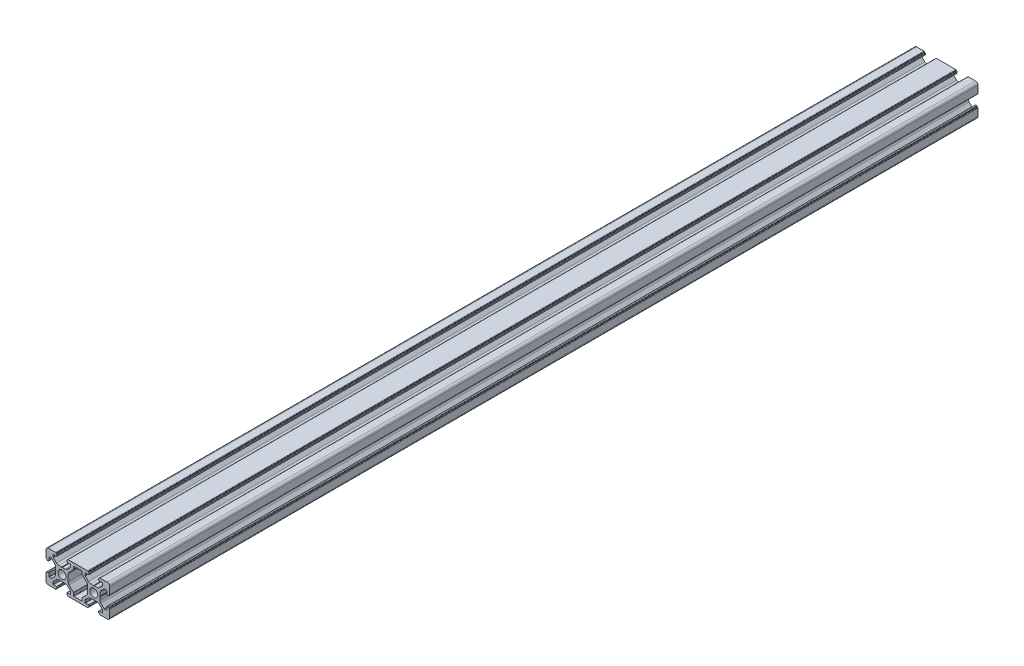
from build123d import *

# Parameters (mm, degrees)
SKETCH_1_R      = 2.5
EXTRUDE_1_DEPTH = 545


with BuildPart() as part:
    # 草图1 → 凸台-拉伸1 (new body)
    with BuildSketch(Plane.XY):
        with BuildLine():
            Line((4.5, -6.68492424), (4.5, -7.9))
            ThreePointArc((4.5, -7.9), (4.587867966, -8.112132034), (4.8, -8.2))
            Line((4.8, -8.2), (6.6, -8.2))
            ThreePointArc((6.6, -8.2), (6.812132034, -8.287867966), (6.9, -8.5))
            Line((6.9, -8.5), (6.9, -9.2))
            ThreePointArc((6.9, -9.2), (6.812132034, -9.412132034), (6.6, -9.5))
            Line((6.6, -9.5), (6.4, -9.5))
            Line((6.4, -9.5), (6.4, -9.7))
            ThreePointArc((6.4, -9.7), (6.312132034, -9.912132034), (6.1, -10))
            Line((6.1, -10), (-6.1, -10))
            ThreePointArc((-6.1, -10), (-6.312132034, -9.912132034), (-6.4, -9.7))
            Line((-6.4, -9.7), (-6.4, -9.5))
            Line((-6.4, -9.5), (-6.6, -9.5))
            ThreePointArc((-6.6, -9.5), (-6.812132034, -9.412132034), (-6.9, -9.2))
            Line((-6.9, -9.2), (-6.9, -8.5))
            ThreePointArc((-6.9, -8.5), (-6.812132034, -8.287867966), (-6.6, -8.2))
            Line((-6.6, -8.2), (-4.8, -8.2))
            ThreePointArc((-4.8, -8.2), (-4.587867966, -8.112132034), (-4.5, -7.9))
            Line((-4.5, -7.9), (-4.5, -6.68492424))
            ThreePointArc((-4.5, -6.68492424), (-4.52283614, -6.570119211), (-4.587867966, -6.472792206))
            Line((-4.587867966, -6.472792206), (-6.574873734, -4.485786438))
            ThreePointArc((-6.574873734, -4.485786438), (-7.223720432, -4.052240935), (-7.989087297, -3.9))
            Line((-7.989087297, -3.9), (-9.8, -3.9))
            Line((-9.8, -3.9), (-10, -3.7))
            Line((-10, -3.7), (-10.2, -3.9))
            Line((-10.2, -3.9), (-12.010912703, -3.9))
            ThreePointArc((-12.010912703, -3.9), (-12.776279568, -4.052240935), (-13.425126266, -4.485786438))
            Line((-13.425126266, -4.485786438), (-15.412132034, -6.472792206))
            ThreePointArc((-15.412132034, -6.472792206), (-15.47716386, -6.570119211), (-15.5, -6.68492424))
            Line((-15.5, -6.68492424), (-15.5, -7.9))
            ThreePointArc((-15.5, -7.9), (-15.412132034, -8.112132034), (-15.2, -8.2))
            Line((-15.2, -8.2), (-13.4, -8.2))
            ThreePointArc((-13.4, -8.2), (-13.187867965, -8.287867966), (-13.1, -8.5))
            Line((-13.1, -8.5), (-13.1, -9.2))
            ThreePointArc((-13.1, -9.2), (-13.187867966, -9.412132034), (-13.4, -9.5))
            Line((-13.4, -9.5), (-13.6, -9.5))
            Line((-13.6, -9.5), (-13.6, -9.7))
            ThreePointArc((-13.6, -9.7), (-13.687867966, -9.912132034), (-13.9, -10))
            Line((-13.9, -10), (-18.5, -10))
            ThreePointArc((-18.5, -10), (-19.560660172, -9.560660172), (-20, -8.5))
            Line((-20, -8.5), (-20, -3.9))
            ThreePointArc((-20, -3.9), (-19.912132034, -3.687867966), (-19.7, -3.6))
            Line((-19.7, -3.6), (-19.5, -3.6))
            Line((-19.5, -3.6), (-19.5, -3.4))
            ThreePointArc((-19.5, -3.4), (-19.412132034, -3.187867966), (-19.2, -3.1))
            Line((-19.2, -3.1), (-18.5, -3.1))
            ThreePointArc((-18.5, -3.1), (-18.287867965, -3.187867966), (-18.2, -3.4))
            Line((-18.2, -3.4), (-18.2, -5.2))
            ThreePointArc((-18.2, -5.2), (-18.112132034, -5.412132034), (-17.9, -5.5))
            Line((-17.9, -5.5), (-16.68492424, -5.5))
            ThreePointArc((-16.68492424, -5.5), (-16.570119211, -5.47716386), (-16.472792206, -5.412132034))
            Line((-16.472792206, -5.412132034), (-14.485786437, -3.425126266))
            ThreePointArc((-14.485786437, -3.425126266), (-14.052240935, -2.776279568), (-13.9, -2.010912703))
            Line((-13.9, -2.010912703), (-13.9, -0.2))
            Line((-13.9, -0.2), (-13.7, 0))
            Line((-13.7, 0), (-13.9, 0.2))
            Line((-13.9, 0.2), (-13.9, 2.010912703))
            ThreePointArc((-13.9, 2.010912703), (-14.052240935, 2.776279568), (-14.485786437, 3.425126266))
            Line((-14.485786437, 3.425126266), (-16.472792206, 5.412132034))
            ThreePointArc((-16.472792206, 5.412132034), (-16.570119211, 5.47716386), (-16.68492424, 5.5))
            Line((-16.68492424, 5.5), (-17.9, 5.5))
            ThreePointArc((-17.9, 5.5), (-18.112132034, 5.412132034), (-18.2, 5.2))
            Line((-18.2, 5.2), (-18.2, 3.4))
            ThreePointArc((-18.2, 3.4), (-18.287867965, 3.187867966), (-18.5, 3.1))
            Line((-18.5, 3.1), (-19.2, 3.1))
            ThreePointArc((-19.2, 3.1), (-19.412132034, 3.187867966), (-19.5, 3.4))
            Line((-19.5, 3.4), (-19.5, 3.6))
            Line((-19.5, 3.6), (-19.7, 3.6))
            ThreePointArc((-19.7, 3.6), (-19.912132034, 3.687867966), (-20, 3.9))
            Line((-20, 3.9), (-20, 8.5))
            ThreePointArc((-20, 8.5), (-19.560660172, 9.560660172), (-18.5, 10))
            Line((-18.5, 10), (-13.9, 10))
            ThreePointArc((-13.9, 10), (-13.687867966, 9.912132034), (-13.6, 9.7))
            Line((-13.6, 9.7), (-13.6, 9.5))
            Line((-13.6, 9.5), (-13.4, 9.5))
            ThreePointArc((-13.4, 9.5), (-13.187867966, 9.412132034), (-13.1, 9.2))
            Line((-13.1, 9.2), (-13.1, 8.5))
            ThreePointArc((-13.1, 8.5), (-13.187867965, 8.287867966), (-13.4, 8.2))
            Line((-13.4, 8.2), (-15.2, 8.2))
            ThreePointArc((-15.2, 8.2), (-15.412132034, 8.112132034), (-15.5, 7.9))
            Line((-15.5, 7.9), (-15.5, 6.68492424))
            ThreePointArc((-15.5, 6.68492424), (-15.47716386, 6.570119211), (-15.412132034, 6.472792206))
            Line((-15.412132034, 6.472792206), (-13.425126266, 4.485786438))
            ThreePointArc((-13.425126266, 4.485786438), (-12.776279568, 4.052240935), (-12.010912703, 3.9))
            Line((-12.010912703, 3.9), (-10.2, 3.9))
            Line((-10.2, 3.9), (-10, 3.7))
            Line((-10, 3.7), (-9.8, 3.9))
            Line((-9.8, 3.9), (-7.989087297, 3.9))
            ThreePointArc((-7.989087297, 3.9), (-7.223720432, 4.052240935), (-6.574873734, 4.485786438))
            Line((-6.574873734, 4.485786438), (-4.587867966, 6.472792206))
            ThreePointArc((-4.587867966, 6.472792206), (-4.52283614, 6.570119211), (-4.5, 6.68492424))
            Line((-4.5, 6.68492424), (-4.5, 7.9))
            ThreePointArc((-4.5, 7.9), (-4.587867966, 8.112132034), (-4.8, 8.2))
            Line((-4.8, 8.2), (-6.6, 8.2))
            ThreePointArc((-6.6, 8.2), (-6.812132034, 8.287867966), (-6.9, 8.5))
            Line((-6.9, 8.5), (-6.9, 9.2))
            ThreePointArc((-6.9, 9.2), (-6.812132034, 9.412132034), (-6.6, 9.5))
            Line((-6.6, 9.5), (-6.4, 9.5))
            Line((-6.4, 9.5), (-6.4, 9.7))
            ThreePointArc((-6.4, 9.7), (-6.312132034, 9.912132034), (-6.1, 10))
            Line((-6.1, 10), (6.1, 10))
            ThreePointArc((6.1, 10), (6.312132034, 9.912132034), (6.4, 9.7))
            Line((6.4, 9.7), (6.4, 9.5))
            Line((6.4, 9.5), (6.6, 9.5))
            ThreePointArc((6.6, 9.5), (6.812132034, 9.412132034), (6.9, 9.2))
            Line((6.9, 9.2), (6.9, 8.5))
            ThreePointArc((6.9, 8.5), (6.812132034, 8.287867966), (6.6, 8.2))
            Line((6.6, 8.2), (4.8, 8.2))
            ThreePointArc((4.8, 8.2), (4.587867966, 8.112132034), (4.5, 7.9))
            Line((4.5, 7.9), (4.5, 6.68492424))
            ThreePointArc((4.5, 6.68492424), (4.52283614, 6.570119211), (4.587867966, 6.472792206))
            Line((4.587867966, 6.472792206), (6.574873734, 4.485786438))
            ThreePointArc((6.574873734, 4.485786438), (7.223720432, 4.052240935), (7.989087297, 3.9))
            Line((7.989087297, 3.9), (9.8, 3.9))
            Line((9.8, 3.9), (10, 3.7))
            Line((10, 3.7), (10.2, 3.9))
            Line((10.2, 3.9), (12.010912703, 3.9))
            ThreePointArc((12.010912703, 3.9), (12.776279568, 4.052240935), (13.425126266, 4.485786438))
            Line((13.425126266, 4.485786438), (15.412132034, 6.472792206))
            ThreePointArc((15.412132034, 6.472792206), (15.47716386, 6.570119211), (15.5, 6.68492424))
            Line((15.5, 6.68492424), (15.5, 7.9))
            ThreePointArc((15.5, 7.9), (15.412132034, 8.112132034), (15.2, 8.2))
            Line((15.2, 8.2), (13.4, 8.2))
            ThreePointArc((13.4, 8.2), (13.187867965, 8.287867966), (13.1, 8.5))
            Line((13.1, 8.5), (13.1, 9.2))
            ThreePointArc((13.1, 9.2), (13.187867966, 9.412132034), (13.4, 9.5))
            Line((13.4, 9.5), (13.6, 9.5))
            Line((13.6, 9.5), (13.6, 9.7))
            ThreePointArc((13.6, 9.7), (13.687867966, 9.912132034), (13.9, 10))
            Line((13.9, 10), (18.5, 10))
            ThreePointArc((18.5, 10), (19.560660172, 9.560660172), (20, 8.5))
            Line((20, 8.5), (20, 3.9))
            ThreePointArc((20, 3.9), (19.912132034, 3.687867966), (19.7, 3.6))
            Line((19.7, 3.6), (19.5, 3.6))
            Line((19.5, 3.6), (19.5, 3.4))
            ThreePointArc((19.5, 3.4), (19.412132034, 3.187867966), (19.2, 3.1))
            Line((19.2, 3.1), (18.5, 3.1))
            ThreePointArc((18.5, 3.1), (18.287867965, 3.187867966), (18.2, 3.4))
            Line((18.2, 3.4), (18.2, 5.2))
            ThreePointArc((18.2, 5.2), (18.112132034, 5.412132034), (17.9, 5.5))
            Line((17.9, 5.5), (16.68492424, 5.5))
            ThreePointArc((16.68492424, 5.5), (16.570119211, 5.47716386), (16.472792206, 5.412132034))
            Line((16.472792206, 5.412132034), (14.485786438, 3.425126266))
            ThreePointArc((14.485786438, 3.425126266), (14.052240935, 2.776279568), (13.9, 2.010912703))
            Line((13.9, 2.010912703), (13.9, 0.2))
            Line((13.9, 0.2), (13.7, 0))
            Line((13.7, 0), (13.9, -0.2))
            Line((13.9, -0.2), (13.9, -2.010912703))
            ThreePointArc((13.9, -2.010912703), (14.052240935, -2.776279568), (14.485786438, -3.425126266))
            Line((14.485786438, -3.425126266), (16.472792206, -5.412132034))
            ThreePointArc((16.472792206, -5.412132034), (16.570119211, -5.47716386), (16.68492424, -5.5))
            Line((16.68492424, -5.5), (17.9, -5.5))
            ThreePointArc((17.9, -5.5), (18.112132034, -5.412132034), (18.2, -5.2))
            Line((18.2, -5.2), (18.2, -3.4))
            ThreePointArc((18.2, -3.4), (18.287867965, -3.187867966), (18.5, -3.1))
            Line((18.5, -3.1), (19.2, -3.1))
            ThreePointArc((19.2, -3.1), (19.412132034, -3.187867966), (19.5, -3.4))
            Line((19.5, -3.4), (19.5, -3.6))
            Line((19.5, -3.6), (19.7, -3.6))
            ThreePointArc((19.7, -3.6), (19.912132034, -3.687867966), (20, -3.9))
            Line((20, -3.9), (20, -8.5))
            ThreePointArc((20, -8.5), (19.560660172, -9.560660172), (18.5, -10))
            Line((18.5, -10), (13.9, -10))
            ThreePointArc((13.9, -10), (13.687867966, -9.912132034), (13.6, -9.7))
            Line((13.6, -9.7), (13.6, -9.5))
            Line((13.6, -9.5), (13.4, -9.5))
            ThreePointArc((13.4, -9.5), (13.187867966, -9.412132034), (13.1, -9.2))
            Line((13.1, -9.2), (13.1, -8.5))
            ThreePointArc((13.1, -8.5), (13.187867965, -8.287867966), (13.4, -8.2))
            Line((13.4, -8.2), (15.2, -8.2))
            ThreePointArc((15.2, -8.2), (15.412132034, -8.112132034), (15.5, -7.9))
            Line((15.5, -7.9), (15.5, -6.68492424))
            ThreePointArc((15.5, -6.68492424), (15.47716386, -6.570119211), (15.412132034, -6.472792206))
            Line((15.412132034, -6.472792206), (13.425126266, -4.485786438))
            ThreePointArc((13.425126266, -4.485786438), (12.776279568, -4.052240935), (12.010912703, -3.9))
            Line((12.010912703, -3.9), (10.2, -3.9))
            Line((10.2, -3.9), (10, -3.7))
            Line((10, -3.7), (9.8, -3.9))
            Line((9.8, -3.9), (7.989087297, -3.9))
            ThreePointArc((7.989087297, -3.9), (7.223720432, -4.052240935), (6.574873734, -4.485786438))
            Line((6.574873734, -4.485786438), (4.587867966, -6.472792206))
            ThreePointArc((4.587867966, -6.472792206), (4.52283614, -6.570119211), (4.5, -6.68492424))
        make_face()
        with Locations((10, 0)):
            Circle(SKETCH_1_R, mode=Mode.SUBTRACT)
        with Locations((-10, 0)):
            Circle(SKETCH_1_R, mode=Mode.SUBTRACT)
        with BuildLine():
            Line((-2.7, -6.363603897), (-2.7, -7.9))
            ThreePointArc((-2.7, -7.9), (-2.612132034, -8.112132034), (-2.4, -8.2))
            Line((-2.4, -8.2), (2.4, -8.2))
            ThreePointArc((2.4, -8.2), (2.612132034, -8.112132034), (2.7, -7.9))
            Line((2.7, -7.9), (2.7, -6.363603897))
            ThreePointArc((2.7, -6.363603897), (2.72283614, -6.248798867), (2.787867966, -6.151471863))
            Line((2.787867966, -6.151471863), (5.514213562, -3.425126266))
            ThreePointArc((5.514213562, -3.425126266), (5.947759065, -2.776279568), (6.1, -2.010912703))
            Line((6.1, -2.010912703), (6.1, 0))
            Line((6.1, 0), (6.1, 2.010912703))
            ThreePointArc((6.1, 2.010912703), (5.947759065, 2.776279568), (5.514213562, 3.425126266))
            Line((5.514213562, 3.425126266), (2.787867966, 6.151471863))
            ThreePointArc((2.787867966, 6.151471863), (2.72283614, 6.248798867), (2.7, 6.363603897))
            Line((2.7, 6.363603897), (2.7, 7.9))
            ThreePointArc((2.7, 7.9), (2.612132034, 8.112132034), (2.4, 8.2))
            Line((2.4, 8.2), (-2.4, 8.2))
            ThreePointArc((-2.4, 8.2), (-2.612132034, 8.112132034), (-2.7, 7.9))
            Line((-2.7, 7.9), (-2.7, 6.363603897))
            ThreePointArc((-2.7, 6.363603897), (-2.72283614, 6.248798867), (-2.787867966, 6.151471863))
            Line((-2.787867966, 6.151471863), (-5.514213562, 3.425126266))
            ThreePointArc((-5.514213562, 3.425126266), (-5.947759065, 2.776279568), (-6.1, 2.010912703))
            Line((-6.1, 2.010912703), (-6.1, 0))
            Line((-6.1, 0), (-6.1, -2.010912703))
            ThreePointArc((-6.1, -2.010912703), (-5.947759065, -2.776279568), (-5.514213562, -3.425126266))
            Line((-5.514213562, -3.425126266), (-2.787867966, -6.151471863))
            ThreePointArc((-2.787867966, -6.151471863), (-2.72283614, -6.248798867), (-2.7, -6.363603897))
        make_face(mode=Mode.SUBTRACT)
    extrude(amount=EXTRUDE_1_DEPTH)


solid = part.part
